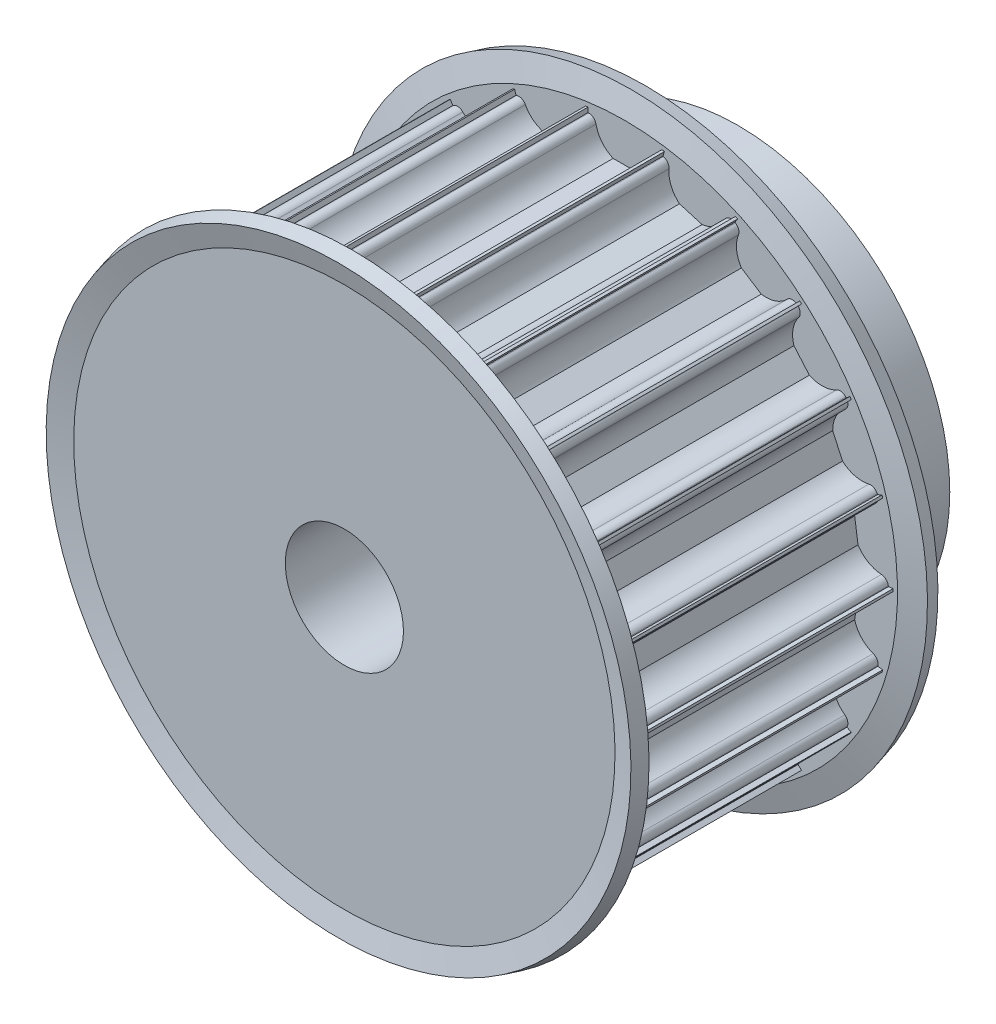
from build123d import *

# Parameters (mm, degrees)
CUT_EXTRUDE1_REACH = 57.544
CIRPATTERN1_COUNT  = 22


with BuildPart() as part:
    # Sketch1 → Revolve1 (revolve)
    with BuildSketch(Plane(origin=(0, 0, 0), x_dir=(0, 0, -1), z_dir=(1, 0, 0)), mode=Mode.PRIVATE) as revolve1_sk:
        Polygon((0, 6), (40, 6), (40, 21.5), (30, 21.5), (30, 27.25), (0, 27.25), align=None)
    revolve(revolve1_sk.sketch.rotate(Axis((0, 0, 0), (0, 0, -1)), 90), axis=Axis((0, 0, 0), (0, 0, -1)))

    # Sketch2 → Cut-Extrude1 (cut, up to next)
    with BuildSketch(Plane.XY, mode=Mode.PRIVATE) as cut_extrude1_sk1:
        with BuildLine():
            Line((-3.674234614, 26.5), (-3.75, 26.5))
            Line((-3.75, 26.5), (-3.75, 28.5))
            Line((-3.75, 28.5), (3.75, 28.5))
            Line((3.75, 28.5), (3.75, 26.5))
            Line((3.75, 26.5), (3.674234614, 26.5))
            ThreePointArc((3.674234614, 26.5), (3.199892965, 26.330947502), (2.939387691, 25.9))
            ThreePointArc((2.939387691, 25.9), (2.331759211, 24.612435701), (1.198957881, 23.75))
            Line((1.198957881, 23.75), (-1.198957881, 23.75))
            ThreePointArc((-1.198957881, 23.75), (-2.331759211, 24.612435701), (-2.939387691, 25.9))
            ThreePointArc((-2.939387691, 25.9), (-3.199892965, 26.330947502), (-3.674234614, 26.5))
        make_face()
    cut_extrude1_tool1 = extrude(cut_extrude1_sk1.sketch, amount=-CUT_EXTRUDE1_REACH, mode=Mode.PRIVATE) & part.part
    cut_extrude1 = cut_extrude1_tool1.solids().sort_by_distance((0, 26.435169, 0))[0]
    add(cut_extrude1, mode=Mode.SUBTRACT)

    # CirPattern1: Cut-Extrude1 ×22 about axis
    cirpattern1_axis = Axis((0, 0, 0), (0, 0, 1))
    for i in range(1, CIRPATTERN1_COUNT):
        add(cut_extrude1.rotate(cirpattern1_axis, i * 360 / CIRPATTERN1_COUNT), mode=Mode.SUBTRACT)

    # Sketch4 → Revolve2 (revolve)
    with BuildSketch(Plane(origin=(0, 0, 0), x_dir=(0, 0, -1), z_dir=(1, 0, 0))):
        Polygon((30, 21.5), (30, 27.492521254), (30.591966801, 29.701771432), (29.143078062, 30.09), (28.5, 27.69), (28.5, 21.5), align=None)
        Polygon((1.5, 27.69), (1.5, 21.5), (0, 21.5), (0, 27.492521254), (-0.591966801, 29.701771432), (0.856921938, 30.09), align=None)
    revolve(axis=Axis((0, 0, 0), (0, 0, 1)))


solid = part.part
